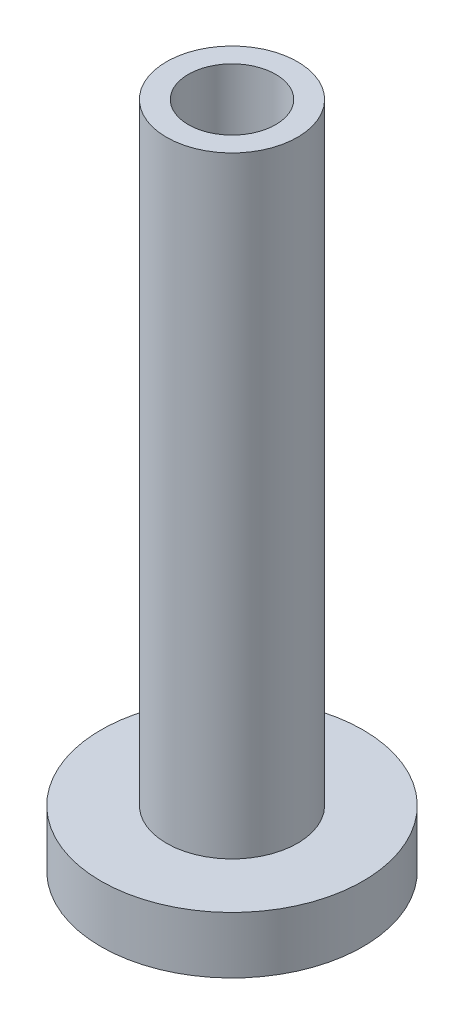
from build123d import *

# Parameters (mm, degrees)
SKETCH_1_R          = 3
EXTRUDE_1_DEPTH     = 1.3
CUT_EXTRUDE_1_DEPTH = 0.6
SKETCH_2_R          = 1.5
SKETCH_2_R_2        = 1
EXTRUDE_2_DEPTH     = 14


with BuildPart() as part:
    # 草图1 → 凸台-拉伸1 (new body)
    with BuildSketch(Plane(origin=(0, 0, 0), x_dir=(1, 0, 0), z_dir=(0, 1, 0))):
        Circle(SKETCH_1_R)
    extrude(amount=EXTRUDE_1_DEPTH)

    # 草图1<3> → 切除-拉伸1 (cut)
    with BuildSketch(Plane(origin=(0, 0, 0), x_dir=(1, 0, 0), z_dir=(0, 1, 0))):
        Polygon((0.577350269, -1), (1.154700538, 0), (0.577350269, 1), (-0.577350269, 1), (-1.154700538, 0), (-0.577350269, -1), align=None)
    extrude(amount=CUT_EXTRUDE_1_DEPTH, mode=Mode.SUBTRACT)

    # 草图2 → 凸台-拉伸2 (add)
    with BuildSketch(Plane(origin=(0, 1.3, 0), x_dir=(1, 0, 0), z_dir=(0, 1, 0))):
        Circle(SKETCH_2_R)
        Circle(SKETCH_2_R_2, mode=Mode.SUBTRACT)
    extrude(amount=EXTRUDE_2_DEPTH)


solid = part.part
